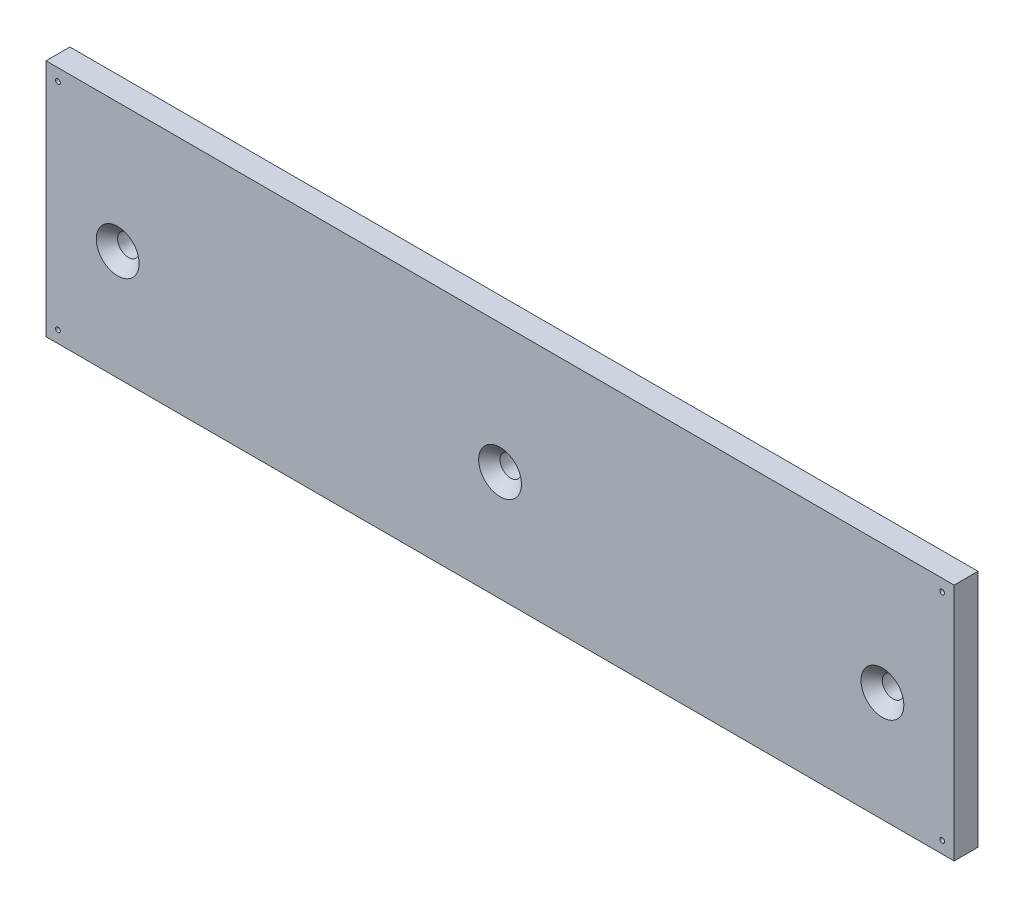
from build123d import *

# Parameters (mm, degrees)
ESBO_O1_W                            = 190
ESBO_O1_H                            = 50
RESSALTO_EXTRUS_O1_DEPTH             = 5
FURO_DE_DI_METRO_1_0_1_1_D           = 1
ESCAREADO_PARA_SFHCS_M41_D           = 4.5
ESCAREADO_PARA_SFHCS_M41_CSINK_D     = 8.96
ESCAREADO_PARA_SFHCS_M41_CSINK_ANGLE = 90
ESCAREADO_PARA_SFHCS_M42_D           = 4.5
ESCAREADO_PARA_SFHCS_M42_CSINK_D     = 8.96
ESCAREADO_PARA_SFHCS_M42_CSINK_ANGLE = 90


with BuildPart() as part:
    # Esboço1 → Ressalto-extrusão1 (new body)
    with BuildSketch(Plane.XY):
        with Locations((95, 25)):
            Rectangle(ESBO_O1_W, ESBO_O1_H)
    extrude(amount=RESSALTO_EXTRUS_O1_DEPTH)

    # Furo de diâmetro Ø1.0 (1)1 (through all)
    with Locations(Plane(origin=(2.5, 47.5, 5), x_dir=(1, 0, 0), z_dir=(0, 0, 1))):
        with Locations((0, 0), (0, -45), (185, -45), (185, 0)):
            Hole(FURO_DE_DI_METRO_1_0_1_1_D / 2)

    # Escareado para SFHCS M41 (through all)
    with Locations(Plane(origin=(15, 23, 5), x_dir=(1, 0, 0), z_dir=(0, 0, 1))):
        with Locations((0, 0), (80, 0)):
            CounterSinkHole(ESCAREADO_PARA_SFHCS_M41_D / 2, ESCAREADO_PARA_SFHCS_M41_CSINK_D / 2, counter_sink_angle=ESCAREADO_PARA_SFHCS_M41_CSINK_ANGLE)

    # Escareado para SFHCS M42 (through all)
    with Locations(Plane(origin=(175, 23, 5), x_dir=(1, 0, 0), z_dir=(0, 0, 1))):
        with Locations((0, 0)):
            CounterSinkHole(ESCAREADO_PARA_SFHCS_M42_D / 2, ESCAREADO_PARA_SFHCS_M42_CSINK_D / 2, counter_sink_angle=ESCAREADO_PARA_SFHCS_M42_CSINK_ANGLE)


solid = part.part
